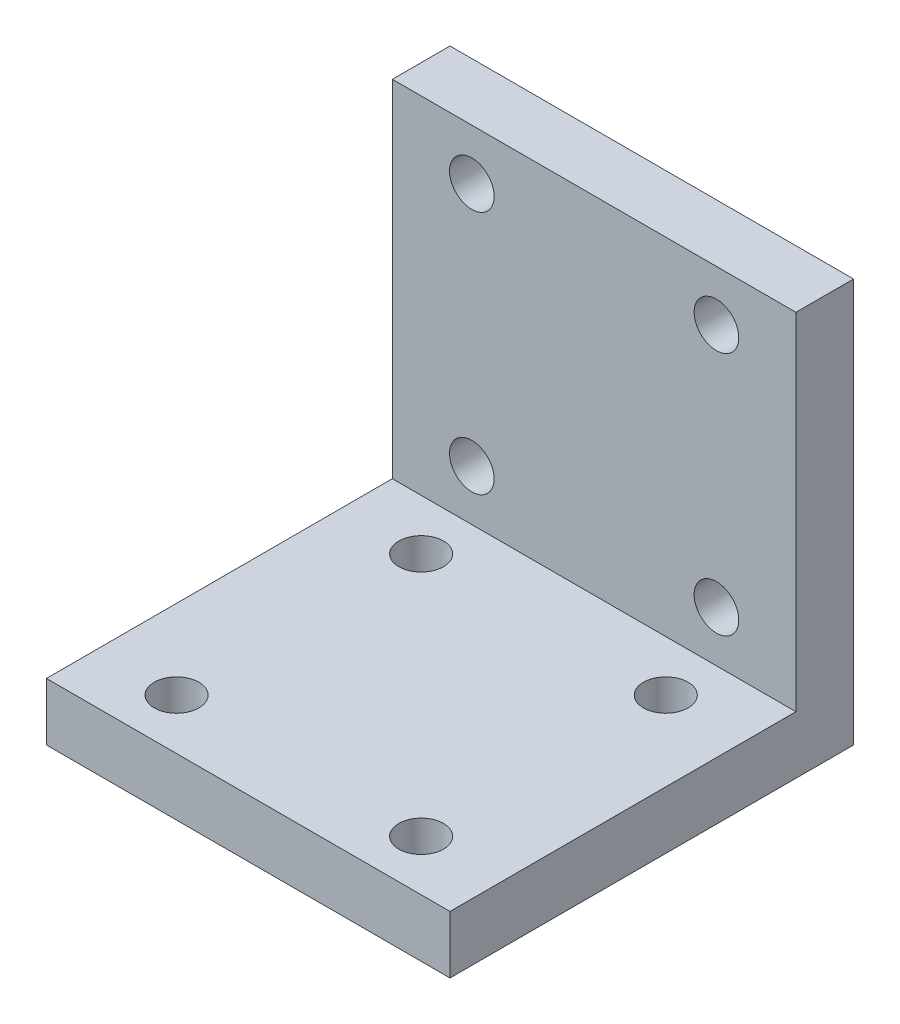
from build123d import *

# Parameters (mm, degrees)
BOSS_EXTRUDE1_DEPTH          = 22.225
F_10_0_1935_DIAMETER_HOLE1_D = 4.9149


with BuildPart() as part:
    # Sketch1 → Boss-Extrude1 (new, symmetric)
    with BuildSketch(Plane(origin=(0, 0, 0), x_dir=(0, 0, -1), z_dir=(1, 0, 0))):
        Polygon((0, 0), (44.45, 0), (44.45, 44.45), (38.1, 44.45), (38.1, 6.35), (0, 6.35), align=None)
    extrude(amount=BOSS_EXTRUDE1_DEPTH, both=True)

    # #10 (0.1935) Diameter Hole1 (through all)
    with Locations(Plane(origin=(0, 6.35, 0), x_dir=(1, 0, 0), z_dir=(0, 1, 0))):
        with Locations((13.470384182, 5.579615818), (-13.470384182, 32.520384182), (-13.470384182, 5.579615818), (13.470384182, 32.520384182)):
            f_10_0_1935_diameter_hole1 = Hole(F_10_0_1935_DIAMETER_HOLE1_D / 2)

    # Mirror1: #10 (0.1935) Diameter Hole1 across plane
    add(f_10_0_1935_diameter_hole1.mirror(Plane(origin=(0, 22.225, -22.225), x_dir=(0, 0.7071067811865476, 0.7071067811865475), z_dir=(0, 0.7071067811865475, -0.7071067811865476))), mode=Mode.SUBTRACT)


solid = part.part
